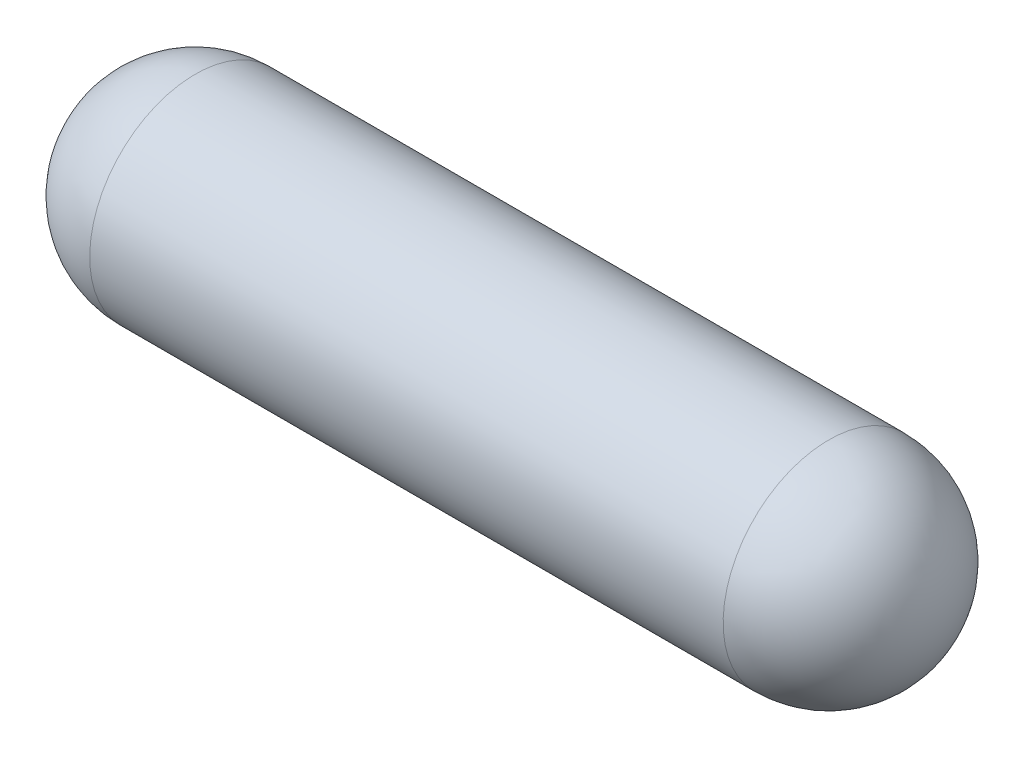
from build123d import *


with BuildPart() as part:
    # Sketch1 → Revolve1 (revolve)
    with BuildSketch(Plane.XY):
        with BuildLine():
            Line((0, 0), (38.1, 0))
            ThreePointArc((38.1, 0), (42.590128061, 1.859871939), (44.45, 6.35))
            Line((44.45, 6.35), (-6.35, 6.35))
            ThreePointArc((-6.35, 6.35), (-4.490128061, 1.859871939), (0, 0))
        make_face()
    revolve(axis=Axis((44.45, 6.35, 0), (-1, 0, 0)))


solid = part.part
